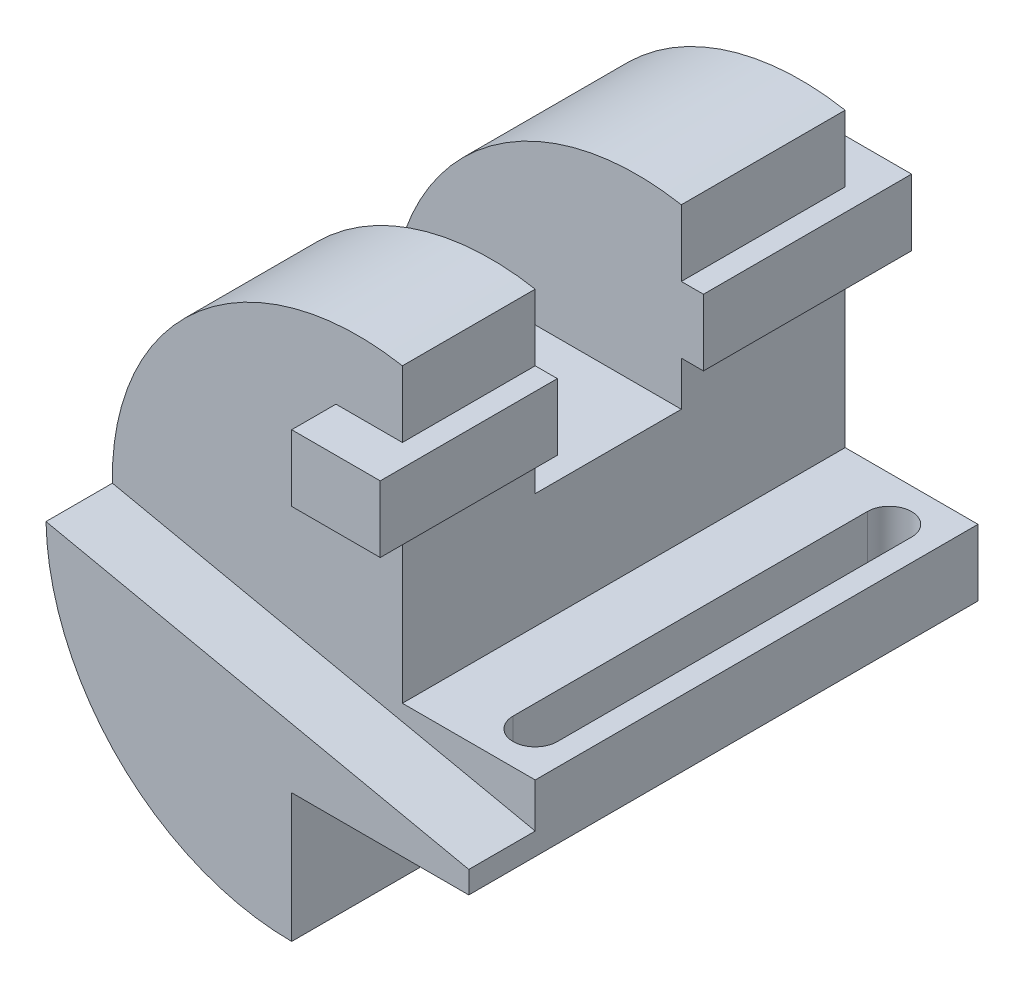
from build123d import *

# Parameters (mm, degrees)
BOSS_EXTRUDE1_DEPTH      = 115
CUT_EXTRUDE1_START       = -15
CUT_EXTRUDE1_DEPTH       = 15
BOSS_EXTRUDE2_DEPTH      = 10
BOSS_EXTRUDE2_DEPTH_BACK = 110
SKETCH3_W                = 20
SKETCH3_H                = 15
CUT_EXTRUDE4_DEPTH       = 156.641335042
CUT_EXTRUDE4_DEPTH_BACK  = 156.641335042
SKETCH4_W                = 33
SKETCH4_H                = 40.908333969
CUT_EXTRUDE5_DEPTH       = 164.774158995
CUT_EXTRUDE5_DEPTH_BACK  = 164.774158995


with BuildPart() as part:
    # Sketch1 → Boss-Extrude1 (new body)
    with BuildSketch(Plane.XY):
        with BuildLine():
            Line((0, 0), (-40, 0))
            Line((-40, 0), (-40, -29.091666031))
            ThreePointArc((-40, -29.091666031), (-95.27245003, 31.428918363), (-30, 81))
            Line((-30, 81), (-30, 15))
            Line((-30, 15), (0, 15))
            Line((0, 15), (0, 0))
        make_face()
    extrude(amount=BOSS_EXTRUDE1_DEPTH)

    # Sketch2 → Cut-Extrude1 (cut)
    with BuildSketch(Plane.XY.offset(115).offset(CUT_EXTRUDE1_START)):
        with BuildLine():
            Line((0, 5), (-95.488867891, 25.296785437))
            ThreePointArc((-95.488867891, 25.296785437), (-75.958605419, 68.683961656), (-30, 81))
            Line((-30, 81), (-30, 15))
            Line((-30, 15), (0, 15))
            Line((0, 15), (0, 5))
        make_face()
    extrude(amount=CUT_EXTRUDE1_DEPTH, mode=Mode.SUBTRACT)

    # Sketch3 → Boss-Extrude2 (add, two sides: drawn at the far end of the back side and taken through both)
    with BuildSketch(Plane(origin=(0, 0, 0), x_dir=(-1, 0, 0), z_dir=(0, 0, -1)).offset(-BOSS_EXTRUDE2_DEPTH_BACK)):
        with Locations((35, 58.5)):
            Rectangle(SKETCH3_W, SKETCH3_H)
    extrude(amount=BOSS_EXTRUDE2_DEPTH + BOSS_EXTRUDE2_DEPTH_BACK)

    # Sketch4 → Cut-Extrude4 (cut, two sides: drawn at the far end of the back side and taken through both)
    with BuildSketch(Plane(origin=(-30, 0, 0), x_dir=(0, 0, -1), z_dir=(1, 0, 0)).offset(-CUT_EXTRUDE4_DEPTH_BACK)):
        with Locations((-53.5, 61.454166985)):
            Rectangle(SKETCH4_W, SKETCH4_H)
    extrude(amount=CUT_EXTRUDE4_DEPTH + CUT_EXTRUDE4_DEPTH_BACK, mode=Mode.SUBTRACT)

    # Sketch5 → Cut-Extrude5 (cut, two sides: drawn at the far end of the back side and taken through both)
    with BuildSketch(Plane(origin=(0, 15, 0), x_dir=(1, 0, 0), z_dir=(0, 1, 0)).offset(-CUT_EXTRUDE5_DEPTH_BACK)):
        with BuildLine():
            Line((-5, -10), (-5, -90))
            ThreePointArc((-5, -90), (-10, -95), (-15, -90))
            Line((-15, -90), (-15, -10))
            ThreePointArc((-15, -10), (-10, -5), (-5, -10))
        make_face()
    extrude(amount=CUT_EXTRUDE5_DEPTH + CUT_EXTRUDE5_DEPTH_BACK, mode=Mode.SUBTRACT)


solid = part.part
